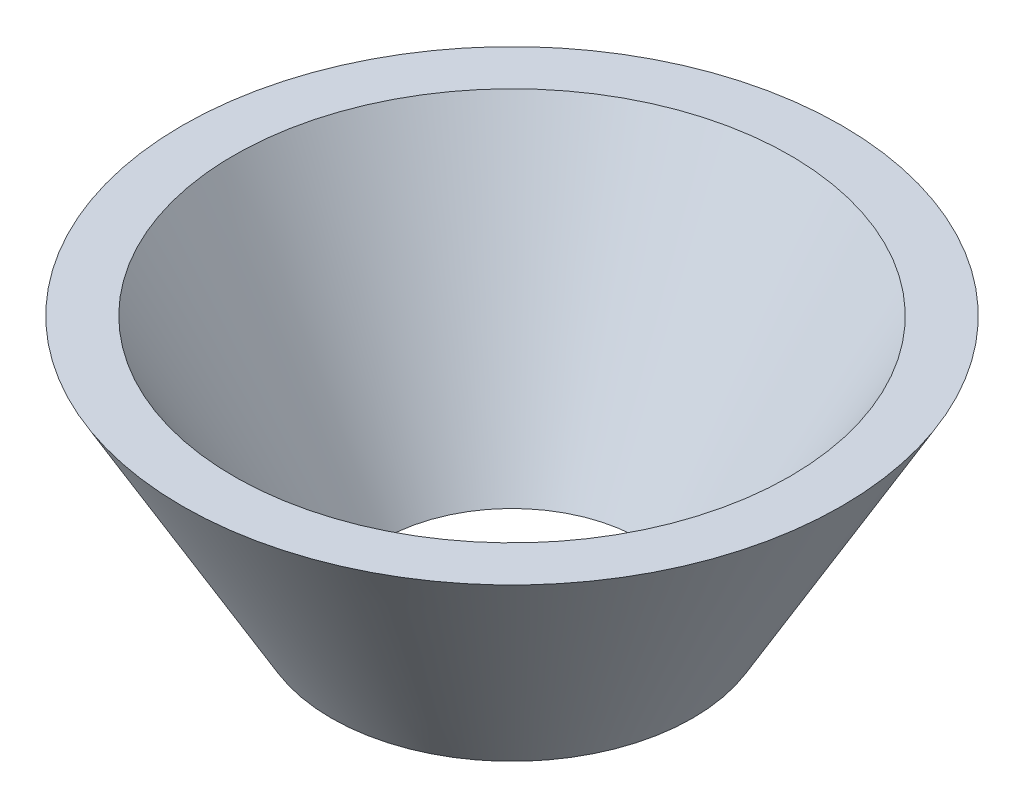
from build123d import *


with BuildPart() as part:
    # Sketch1 → Revolve1 (revolve)
    with BuildSketch(Plane.XY, mode=Mode.PRIVATE) as revolve1_sk:
        Polygon((-25, 0), (-53.867513459, 50), (-63.867513459, 50), (-35, 0), align=None)
    revolve(revolve1_sk.sketch.rotate(Axis((0, 0, 0), (0, 1, 0)), 180), axis=Axis((0, 0, 0), (0, 1, 0)))


solid = part.part
